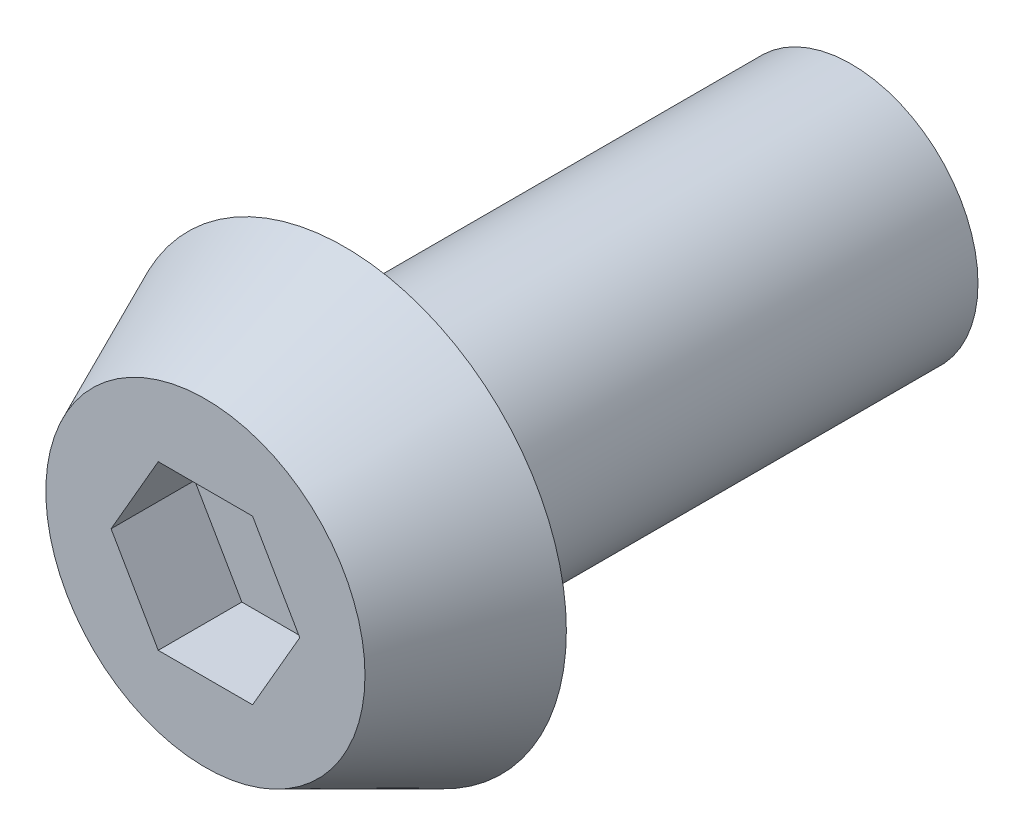
from build123d import *

# Parameters (mm, degrees)
SK_SHANK_R   = 1
SHANK_DEPTH  = 4
SK_HEAD_R    = 1.75
HEAD_DEPTH   = 1.1
HEAD_TAPER   = 24.010799064
SOCKET_START = 0.44
SOCKET_DEPTH = 1.16


with BuildPart() as part:
    # SK_shank → Shank (new body)
    with BuildSketch(Plane.XY):
        Circle(SK_SHANK_R)
    extrude(amount=-SHANK_DEPTH)

    # SK_head → Head (add)
    with BuildSketch(Plane.XY):
        Circle(SK_HEAD_R)
    extrude(amount=HEAD_DEPTH, taper=HEAD_TAPER)

    # SK_socket → Socket (cut)
    with BuildSketch(Plane.XY.offset(SOCKET_START)):
        Polygon((0.744781847, 0), (0.372390924, -0.645), (-0.372390924, -0.645), (-0.744781847, 0), (-0.372390924, 0.645), (0.372390924, 0.645), align=None)
    extrude(amount=SOCKET_DEPTH, mode=Mode.SUBTRACT)


solid = part.part
